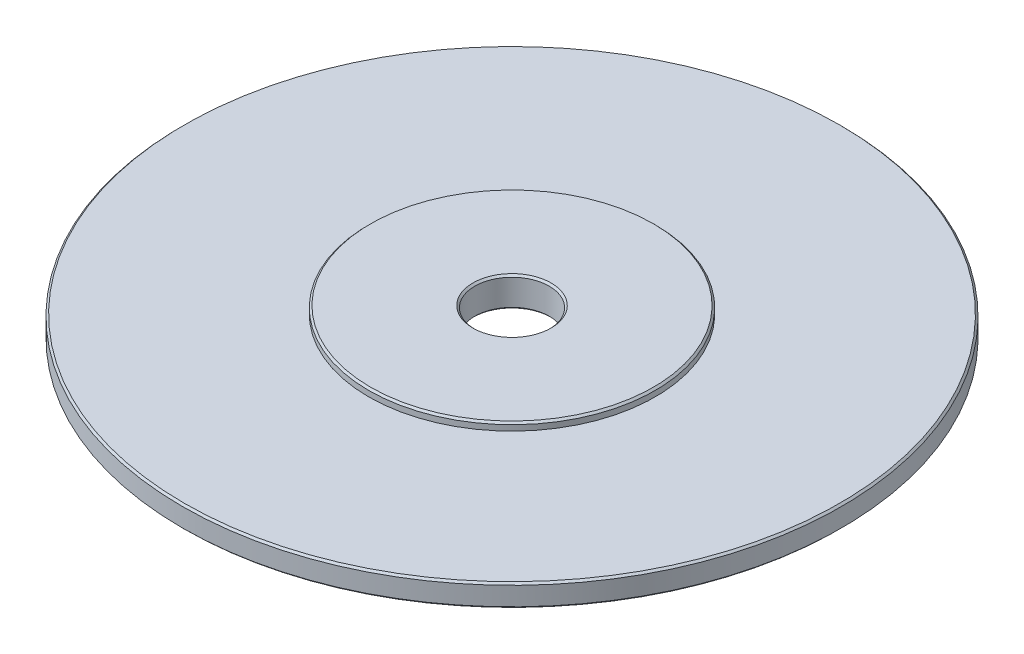
from build123d import *

# Parameters (mm, degrees)
CHAMFER_1_SIZE = 0.5


with BuildPart() as part:
    # 草图2 → 旋转1 (revolve)
    with BuildSketch(Plane(origin=(0, 0, 0), x_dir=(0, 0, -1), z_dir=(1, 0, 0))):
        Polygon((10, 0), (88.5, 0), (88.5, 6), (38.5, 6), (38.5, 8), (10, 8), align=None)
    revolve(axis=Axis((0, 0, 0), (0, 1, 0)))

    # 倒角1
    chamfer_1_edges = [part.edges().sort_by_distance(p)[0] for p in [
        (0, 0, 88.5),
        (0, 0, 10),
        (0, 8, 10),
        (0, 8, 38.5),
        (0, 6, 88.5),
    ]]
    chamfer(chamfer_1_edges, length=CHAMFER_1_SIZE)


solid = part.part
